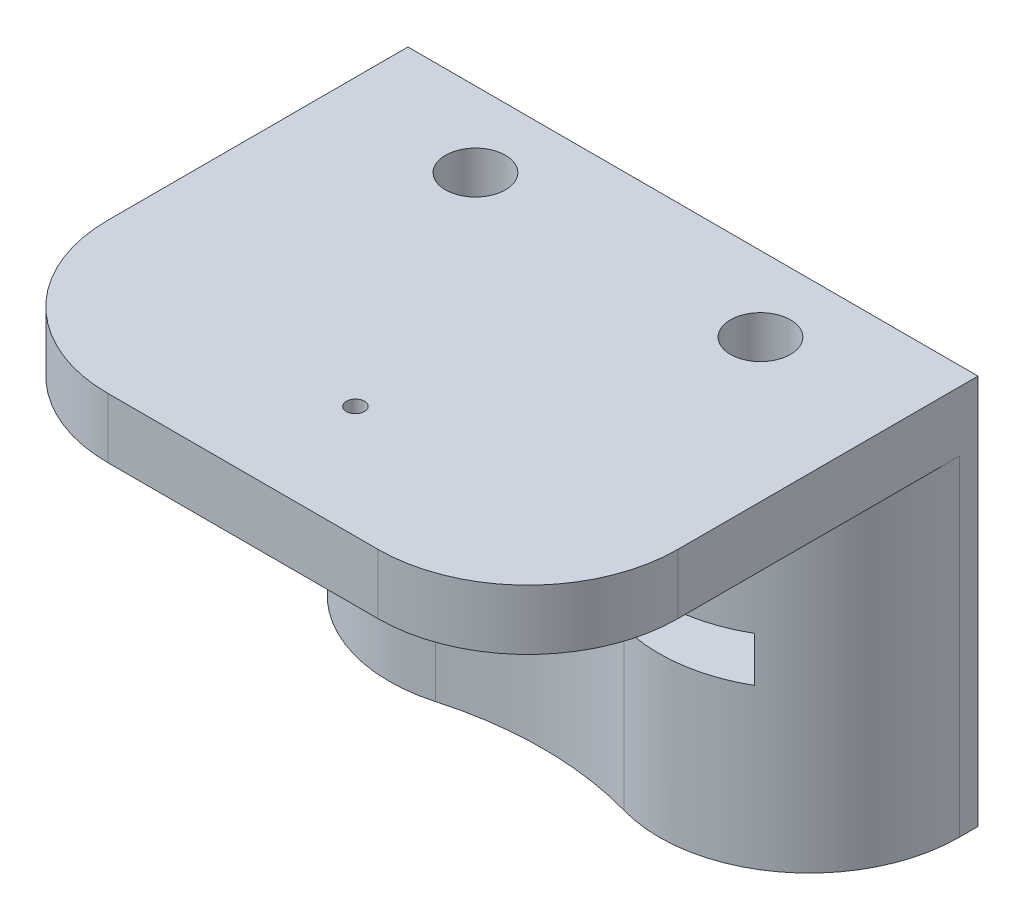
from build123d import *

# Parameters (mm, degrees)
CROQUIS2_R              = 0.6
SALIENTE_EXTRUIR1_DEPTH = 4
SALIENTE_EXTRUIR2_DEPTH = 22
REDONDEO1_R             = 10
REDONDEO2_R             = 10
CROQUIS4_R              = 2
CORTAR_EXTRUIR1_DEPTH   = 15.4
CROQUIS5_W              = 9
CROQUIS5_H              = 3
CORTAR_EXTRUIR2_DEPTH   = 12


with BuildPart() as part:
    # Croquis2 → Saliente-Extruir1 (new body)
    with BuildSketch(Plane(origin=(0, 0, 0), x_dir=(1, 0, 0), z_dir=(0, 1, 0))):
        with BuildLine():
            Line((-43.107082341, -17.625158928), (-5.107082341, -17.625158928))
            Line((-5.107082341, -17.625158928), (-5.107082341, -37.625158928))
            ThreePointArc((-5.107082341, -37.625158928), (-8.036014529, -44.69622674), (-15.107082341, -47.625158928))
            Line((-15.107082341, -47.625158928), (-33.107082341, -47.625158928))
            ThreePointArc((-33.107082341, -47.625158928), (-40.178150153, -44.69622674), (-43.107082341, -37.625158928))
            Line((-43.107082341, -37.625158928), (-43.107082341, -17.625158928))
        make_face()
        with Locations(Location((-24.107082341, -40.125158928, 0), (0, 0, 270))):
            Circle(CROQUIS2_R, mode=Mode.SUBTRACT)
    extrude(amount=SALIENTE_EXTRUIR1_DEPTH)

    # Croquis3 → Saliente-Extruir2 (add)
    with BuildSketch(Plane.XZ):
        with BuildLine():
            Line((-43.107082341, 17.625158928), (-5.107082341, 17.625158928))
            Line((-5.107082341, 17.625158928), (-5.107082341, 37.625158928))
            ThreePointArc((-5.107082341, 37.625158928), (-24.107082341, 27.625158928), (-43.107082341, 37.625158928))
            Line((-43.107082341, 37.625158928), (-43.107082341, 17.625158928))
        make_face()
    extrude(amount=SALIENTE_EXTRUIR2_DEPTH)

    # Redondeo1
    redondeo1_edges = [part.edges().sort_by_distance(p)[0] for p in [
        (-43.107082341, -11, 37.625158928),
    ]]
    fillet(redondeo1_edges, radius=REDONDEO1_R)

    # Redondeo2
    redondeo2_edges = [part.edges().sort_by_distance(p)[0] for p in [
        (-5.107082341, -11, 37.625158928),
    ]]
    fillet(redondeo2_edges, radius=REDONDEO2_R)

    # Croquis4 → Cortar-Extruir1 (cut)
    with BuildSketch(Plane(origin=(0, 4, 0), x_dir=(1, 0, 0), z_dir=(0, 1, 0))):
        with Locations(Location((-33.607082341, -22.625158928, 0), (0, 0, 270))):
            Circle(CROQUIS4_R)
        with Locations(Location((-14.607082341, -22.625158928, 0), (0, 0, 270))):
            Circle(CROQUIS4_R)
    extrude(amount=-CORTAR_EXTRUIR1_DEPTH, mode=Mode.SUBTRACT)

    # Croquis5 → Cortar-Extruir2 (cut)
    with BuildSketch(Plane(origin=(0, 0, 17.625158928), x_dir=(-1, 0, 0), z_dir=(0, 0, -1))):
        with Locations((33.607082341, -9.9)):
            Rectangle(CROQUIS5_W, CROQUIS5_H)
        with Locations((14.607082341, -9.9)):
            Rectangle(CROQUIS5_W, CROQUIS5_H)
    extrude(amount=-CORTAR_EXTRUIR2_DEPTH, mode=Mode.SUBTRACT)


solid = part.part
